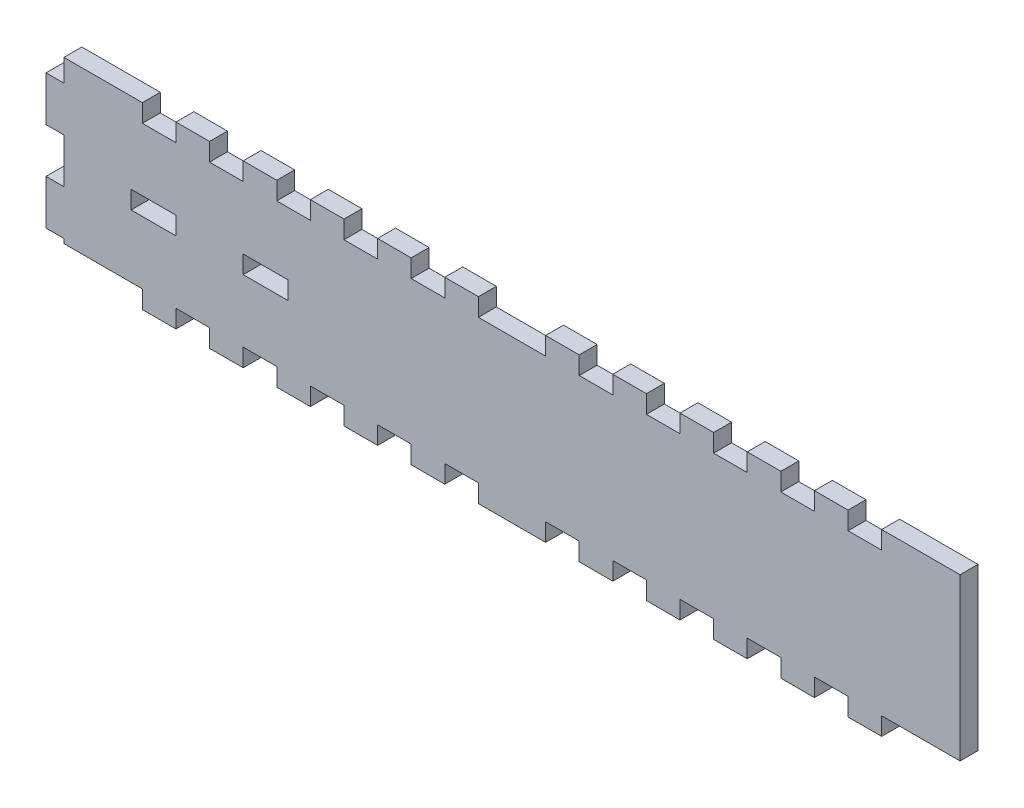
from build123d import *

# Parameters (mm, degrees)
ESQUISSE1_W             = 400
ESQUISSE1_H             = 80
BOSS_EXTRU_1_DEPTH      = 8
ESQUISSE2_W             = 8
ESQUISSE2_H             = 20
BOSS_EXTRU_2_DEPTH      = 8
ESQUISSE4_W             = 15
ESQUISSE4_H             = 8
ENL_V_MAT_EXTRU_1_DEPTH = 212.962260792
ESQUISSE5_W             = 15
ESQUISSE5_H             = 8
ESQUISSE5_W_2           = 35
ENL_V_MAT_EXTRU_2_DEPTH = 212.962260792
ESQUISSE6_W             = 20
ESQUISSE6_H             = 8
ENL_V_MAT_EXTRU_3_DEPTH = 212.962260792


with BuildPart() as part:
    # Esquisse1 → Boss.-Extru.1 (new body)
    with BuildSketch(Plane.XY):
        Rectangle(ESQUISSE1_W, ESQUISSE1_H)
    extrude(amount=BOSS_EXTRU_1_DEPTH)

    # Esquisse2 → Boss.-Extru.2 (add)
    with BuildSketch(Plane.XY):
        with Locations((-204, 20)):
            Rectangle(ESQUISSE2_W, ESQUISSE2_H)
        with Locations((-204, -20)):
            Rectangle(ESQUISSE2_W, ESQUISSE2_H)
    extrude(amount=BOSS_EXTRU_2_DEPTH)

    # Esquisse4 → Enlèv. mat.-Extru.1 (cut, through all)
    with BuildSketch(Plane.XY):
        Polygon((0, 40), (-15, 40), (-15, 32), (0, 32), (15, 32), (15, 40), align=None)
        with Locations((-37.5, 36)):
            Rectangle(ESQUISSE4_W, ESQUISSE4_H)
        with Locations((-67.5, 36)):
            Rectangle(ESQUISSE4_W, ESQUISSE4_H)
        with Locations((-97.5, 36)):
            Rectangle(ESQUISSE4_W, ESQUISSE4_H)
        with Locations((-127.5, 36)):
            Rectangle(ESQUISSE4_W, ESQUISSE4_H)
        with Locations((-157.5, 36)):
            Rectangle(ESQUISSE4_W, ESQUISSE4_H)
        with Locations((37.5, 36)):
            Rectangle(ESQUISSE4_W, ESQUISSE4_H)
        with Locations((67.5, 36)):
            Rectangle(ESQUISSE4_W, ESQUISSE4_H)
        with Locations((97.5, 36)):
            Rectangle(ESQUISSE4_W, ESQUISSE4_H)
        with Locations((127.5, 36)):
            Rectangle(ESQUISSE4_W, ESQUISSE4_H)
        with Locations((157.5, 36)):
            Rectangle(ESQUISSE4_W, ESQUISSE4_H)
    extrude(amount=ENL_V_MAT_EXTRU_1_DEPTH, mode=Mode.SUBTRACT)

    # Esquisse5 → Enlèv. mat.-Extru.2 (cut, through all)
    with BuildSketch(Plane.XY):
        with Locations((-22.5, -36)):
            Rectangle(ESQUISSE5_W, ESQUISSE5_H)
        with Locations((-52.5, -36)):
            Rectangle(ESQUISSE5_W, ESQUISSE5_H)
        with Locations((-82.5, -36)):
            Rectangle(ESQUISSE5_W, ESQUISSE5_H)
        with Locations((-112.5, -36)):
            Rectangle(ESQUISSE5_W, ESQUISSE5_H)
        with Locations((-142.5, -36)):
            Rectangle(ESQUISSE5_W, ESQUISSE5_H)
        with Locations((-182.5, -36)):
            Rectangle(ESQUISSE5_W_2, ESQUISSE5_H)
        with Locations((22.5, -36)):
            Rectangle(ESQUISSE5_W, ESQUISSE5_H)
        with Locations((52.5, -36)):
            Rectangle(ESQUISSE5_W, ESQUISSE5_H)
        with Locations((82.5, -36)):
            Rectangle(ESQUISSE5_W, ESQUISSE5_H)
        with Locations((112.5, -36)):
            Rectangle(ESQUISSE5_W, ESQUISSE5_H)
        with Locations((142.5, -36)):
            Rectangle(ESQUISSE5_W, ESQUISSE5_H)
        with Locations((182.5, -36)):
            Rectangle(ESQUISSE5_W_2, ESQUISSE5_H)
    extrude(amount=ENL_V_MAT_EXTRU_2_DEPTH, mode=Mode.SUBTRACT)

    # Esquisse6 → Enlèv. mat.-Extru.3 (cut, through all)
    with BuildSketch(Plane.XY):
        with Locations((-160, 0)):
            Rectangle(ESQUISSE6_W, ESQUISSE6_H)
        with Locations((-110, 0)):
            Rectangle(ESQUISSE6_W, ESQUISSE6_H)
    extrude(amount=ENL_V_MAT_EXTRU_3_DEPTH, mode=Mode.SUBTRACT)


solid = part.part
